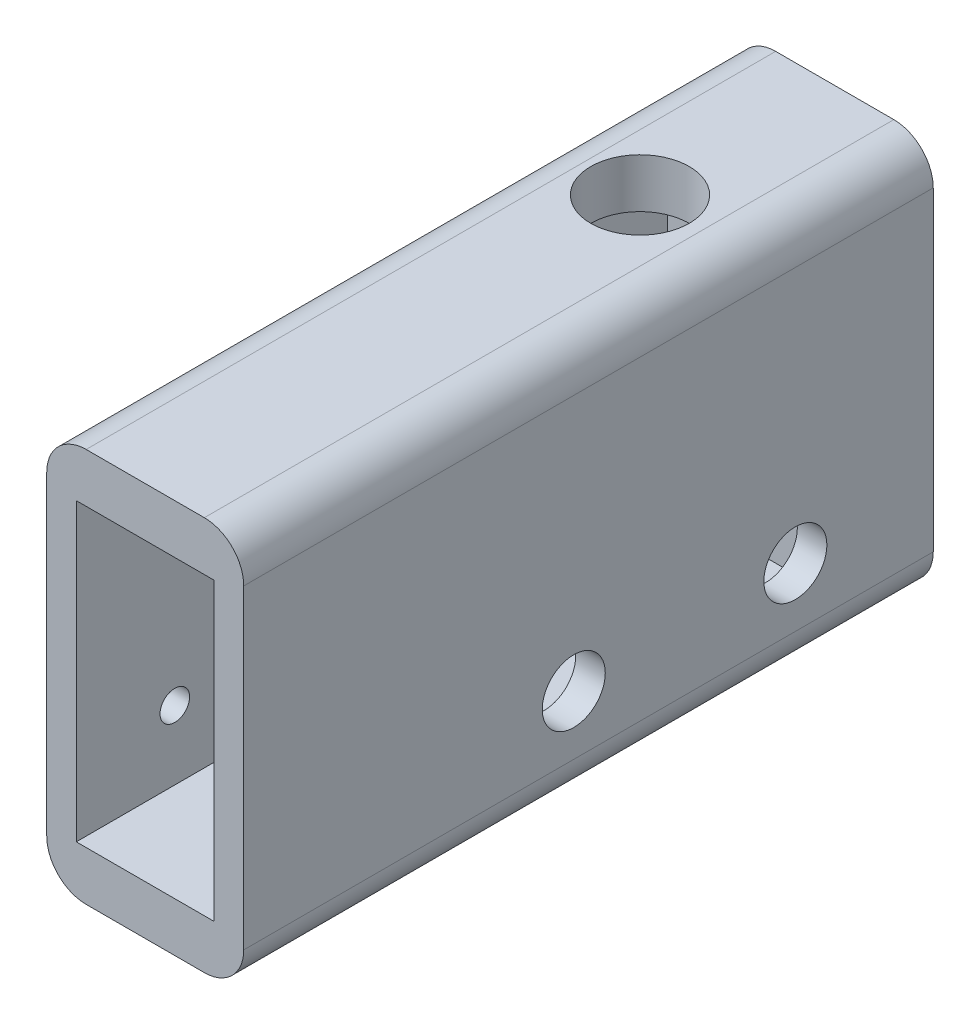
from build123d import *

# Parameters (mm, degrees)
ESQUISSE1_W             = 10
ESQUISSE1_H             = 20
BOSS_EXTRU_1_DEPTH      = 35
ESQUISSE2_W             = 7
ESQUISSE2_H             = 15
ENL_V_MAT_EXTRU_1_DEPTH = 30
ESQUISSE3_R             = 1.55
ENL_V_MAT_EXTRU_2_DEPTH = 38.416573868
ESQUISSE4_R             = 2.5
ENL_V_MAT_EXTRU_3_DEPTH = 5
ESQUISSE5_R             = 0.75
ENL_V_MAT_EXTRU_4_DEPTH = 2.5
CONG_1_R                = 2
ESQUISSE6_R             = 1.6
ENL_V_MAT_EXTRU_5_DEPTH = 42.533119315


with BuildPart() as part:
    # Esquisse1 → Boss.-Extru.1 (new body)
    with BuildSketch(Plane.XY):
        with Locations((5, 10)):
            Rectangle(ESQUISSE1_W, ESQUISSE1_H)
    extrude(amount=BOSS_EXTRU_1_DEPTH)

    # Esquisse2 → Enlèv. mat.-Extru.1 (cut)
    with BuildSketch(Plane.XY.offset(35)):
        with Locations((5, 10)):
            Rectangle(ESQUISSE2_W, ESQUISSE2_H)
    extrude(amount=-ENL_V_MAT_EXTRU_1_DEPTH, mode=Mode.SUBTRACT)

    # Esquisse3 → Enlèv. mat.-Extru.2 (cut, through all)
    with BuildSketch(Plane.XY.offset(5)):
        with Locations((5, 14.527380154)):
            Circle(ESQUISSE3_R)
        with Locations((5, 6.280248244)):
            Circle(ESQUISSE3_R)
    extrude(amount=-ENL_V_MAT_EXTRU_2_DEPTH, mode=Mode.SUBTRACT)

    # Esquisse4 → Enlèv. mat.-Extru.3 (cut)
    with BuildSketch(Plane(origin=(0, 20, 0), x_dir=(1, 0, 0), z_dir=(0, 1, 0))):
        with Locations(Location((4.86841115, -9.754551776, 0), (0, 0, 270))):
            Circle(ESQUISSE4_R)
    extrude(amount=-ENL_V_MAT_EXTRU_3_DEPTH, mode=Mode.SUBTRACT)

    # Esquisse5 → Enlèv. mat.-Extru.4 (cut)
    with BuildSketch(Plane.ZY):
        with Locations((30, 14)):
            Circle(ESQUISSE5_R)
        with Locations((30, 6)):
            Circle(ESQUISSE5_R)
    extrude(amount=-ENL_V_MAT_EXTRU_4_DEPTH, mode=Mode.SUBTRACT)

    # Congé1
    cong_1_edges = [part.edges().sort_by_distance(p)[0] for p in [
        (0, 20, 17.5),
        (10, 20, 17.5),
        (10, 0, 17.5),
        (0, 0, 17.5),
    ]]
    fillet(cong_1_edges, radius=CONG_1_R)

    # Esquisse6 → Enlèv. mat.-Extru.5 (cut, through all)
    with BuildSketch(Plane(origin=(10, 0, 0), x_dir=(0, 0, -1), z_dir=(1, 0, 0))):
        with Locations((-7, 5)):
            Circle(ESQUISSE6_R)
        with Locations((-18.24812381, 5)):
            Circle(ESQUISSE6_R)
    extrude(amount=-ENL_V_MAT_EXTRU_5_DEPTH, mode=Mode.SUBTRACT)


solid = part.part
